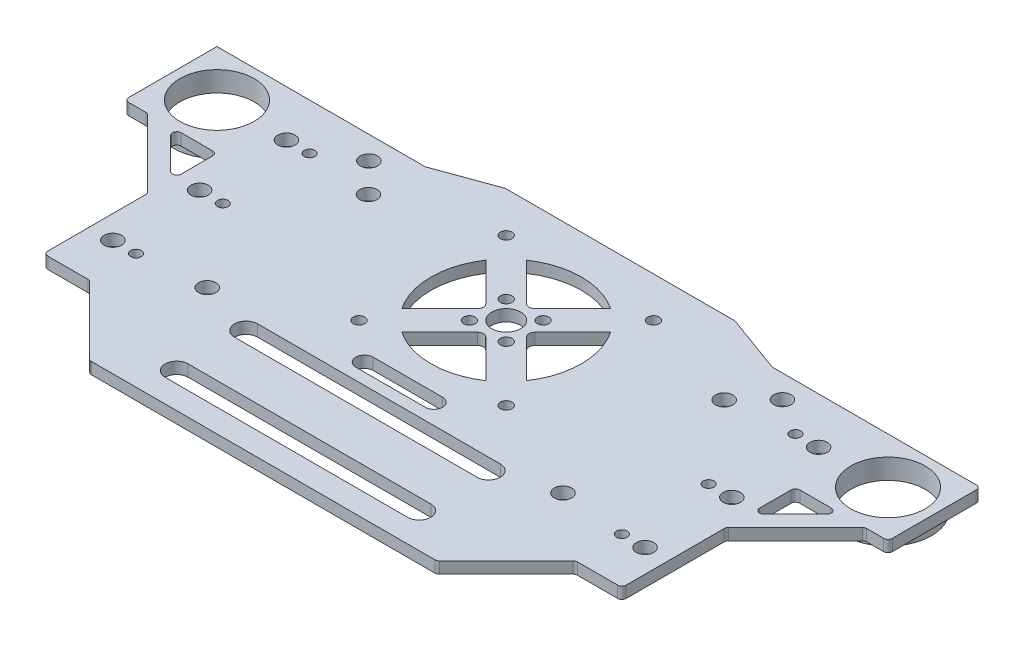
from build123d import *
from build123d.topology import SkipClean

# Parameters (mm, degrees)
SKETCH_1_R      = 1.5
SKETCH_1_R_2    = 0.925
SKETCH_1_R_3    = 1
SKETCH_1_R_4    = 15
SKETCH_1_R_5    = 2.5
SKETCH_1_R_6    = 6.425
EXTRUDE_1_DEPTH = 2
FILLET_1_R      = 0.75
EXTRUDE_START   = 1.5
SKETCH_3_R      = 7.5
SKETCH_3_R_2    = 6.425
EXTRUDE_2_DEPTH = 1.5


with BuildPart() as part:
    # 草图1 → 凸台-拉伸1 (new body)
    # profile 1 of 11: a face of its own
    with BuildSketch(Plane(origin=(0, 0, 0), x_dir=(1, 0, 0), z_dir=(0, 1, 0))):
        Polygon((-19.848034865, 26.695013128), (-30, 23), (30, 23), (19.848034865, 26.695013128), (0.026493373, 26.695013128), (-0.026493373, 26.695013128), align=None)
    # profile 2 of 11: a face of its own
    with BuildSketch(Plane(origin=(0, 0, 0), x_dir=(1, 0, 0), z_dir=(0, 1, 0))):
        Polygon((-19.848034865, 26.695013128), (-30, 23), (30, 23), (19.848034865, 26.695013128), (0.026493373, 26.695013128), (-0.026493373, 26.695013128), align=None)
    # profile 3 of 11: a face of its own
    with BuildSketch(Plane(origin=(0, 0, 0), x_dir=(1, 0, 0), z_dir=(0, 1, 0))):
        Polygon((-30, 23), (-50, 23), (-50, 7), (-50, -1), (-50, -5), (-50, -23), (-42, -23), (42, -23), (50, -23), (50, -5), (50, -1), (50, 7), (50, 23), (30, 23), align=None)
        with Locations(Location((-46, -15, 0), (0, 0, 270))):
            Circle(SKETCH_1_R, mode=Mode.SUBTRACT)
        with Locations(Location((-42, -15, 0), (0, 0, 270))):
            Circle(SKETCH_1_R_2, mode=Mode.SUBTRACT)
        with Locations(Location((-30.7465, -13.935, 0), (0, 0, 270))):
            Circle(SKETCH_1_R, mode=Mode.SUBTRACT)
        with Locations(Location((-12.727922061, -5.727922061, 0), (0, 0, 270))):
            Circle(SKETCH_1_R_3, mode=Mode.SUBTRACT)
        with BuildLine():
            ThreePointArc((-20.969611628, -19), (-22.969611628, -17), (-20.969611628, -15))
            Line((-20.969611628, -15), (20.969611628, -15))
            ThreePointArc((20.969611628, -15), (22.969611628, -17), (20.969611628, -19))
            Line((20.969611628, -19), (-20.969611628, -19))
        make_face(mode=Mode.SUBTRACT)
        with Locations(Location((30.7465, -13.935, 0), (0, 0, 270))):
            Circle(SKETCH_1_R, mode=Mode.SUBTRACT)
        with BuildLine():
            ThreePointArc((-6, -13), (-7.5, -11.5), (-6, -10))
            Line((-6, -10), (6, -10))
            ThreePointArc((6, -10), (7.5, -11.5), (6, -13))
            Line((6, -13), (-6, -13))
        make_face(mode=Mode.SUBTRACT)
        with Locations(Location((12.727922061, -5.727922061, 0), (0, 0, 270))):
            Circle(SKETCH_1_R_3, mode=Mode.SUBTRACT)
        with Locations(Location((42, -15, 0), (0, 0, 270))):
            Circle(SKETCH_1_R_2, mode=Mode.SUBTRACT)
        with Locations(Location((46, -15, 0), (0, 0, 270))):
            Circle(SKETCH_1_R, mode=Mode.SUBTRACT)
        with Locations(Location((-46, 0, 0), (0, 0, 270))):
            Circle(SKETCH_1_R, mode=Mode.SUBTRACT)
        with Locations(Location((-42, 0, 0), (0, 0, 270))):
            Circle(SKETCH_1_R_2, mode=Mode.SUBTRACT)
        with Locations(Location((-46, 15, 0), (0, 0, 270))):
            Circle(SKETCH_1_R, mode=Mode.SUBTRACT)
        with Locations(Location((-42, 15, 0), (0, 0, 270))):
            Circle(SKETCH_1_R_2, mode=Mode.SUBTRACT)
        with Locations(Location((-35.7465, 19, 0), (0, 0, 270))):
            Circle(SKETCH_1_R, mode=Mode.SUBTRACT)
        with Locations(Location((-30.7465, 13.935, 0), (0, 0, 270))):
            Circle(SKETCH_1_R, mode=Mode.SUBTRACT)
        with Locations(Location((-12.727922061, 19.727922061, 0), (0, 0, 270))):
            Circle(SKETCH_1_R_3, mode=Mode.SUBTRACT)
        with Locations((0, 7)):
            Circle(SKETCH_1_R_4, mode=Mode.SUBTRACT)
        with Locations(Location((42, 0, 0), (0, 0, 270))):
            Circle(SKETCH_1_R_2, mode=Mode.SUBTRACT)
        with Locations(Location((46, 0, 0), (0, 0, 270))):
            Circle(SKETCH_1_R, mode=Mode.SUBTRACT)
        with Locations(Location((30.7465, 13.935, 0), (0, 0, 270))):
            Circle(SKETCH_1_R, mode=Mode.SUBTRACT)
        with Locations(Location((12.727922061, 19.727922061, 0), (0, 0, 270))):
            Circle(SKETCH_1_R_3, mode=Mode.SUBTRACT)
        with Locations(Location((42, 15, 0), (0, 0, 270))):
            Circle(SKETCH_1_R_2, mode=Mode.SUBTRACT)
        with Locations(Location((46, 15, 0), (0, 0, 270))):
            Circle(SKETCH_1_R, mode=Mode.SUBTRACT)
        with Locations(Location((35.7465, 19, 0), (0, 0, 270))):
            Circle(SKETCH_1_R, mode=Mode.SUBTRACT)
    # profile 4 of 11: a face of its own
    with BuildSketch(Plane(origin=(0, 0, 0), x_dir=(1, 0, 0), z_dir=(0, 1, 0))):
        Polygon((-30, 23), (-50, 23), (-50, 7), (-50, -1), (-50, -5), (-50, -23), (-42, -23), (42, -23), (50, -23), (50, -5), (50, -1), (50, 7), (50, 23), (30, 23), align=None)
        with Locations(Location((-46, -15, 0), (0, 0, 270))):
            Circle(SKETCH_1_R, mode=Mode.SUBTRACT)
        with Locations(Location((-42, -15, 0), (0, 0, 270))):
            Circle(SKETCH_1_R_2, mode=Mode.SUBTRACT)
        with Locations(Location((-30.7465, -13.935, 0), (0, 0, 270))):
            Circle(SKETCH_1_R, mode=Mode.SUBTRACT)
        with Locations(Location((-12.727922061, -5.727922061, 0), (0, 0, 270))):
            Circle(SKETCH_1_R_3, mode=Mode.SUBTRACT)
        with BuildLine():
            ThreePointArc((-20.969611628, -19), (-22.969611628, -17), (-20.969611628, -15))
            Line((-20.969611628, -15), (20.969611628, -15))
            ThreePointArc((20.969611628, -15), (22.969611628, -17), (20.969611628, -19))
            Line((20.969611628, -19), (-20.969611628, -19))
        make_face(mode=Mode.SUBTRACT)
        with Locations(Location((30.7465, -13.935, 0), (0, 0, 270))):
            Circle(SKETCH_1_R, mode=Mode.SUBTRACT)
        with BuildLine():
            ThreePointArc((-6, -13), (-7.5, -11.5), (-6, -10))
            Line((-6, -10), (6, -10))
            ThreePointArc((6, -10), (7.5, -11.5), (6, -13))
            Line((6, -13), (-6, -13))
        make_face(mode=Mode.SUBTRACT)
        with Locations(Location((12.727922061, -5.727922061, 0), (0, 0, 270))):
            Circle(SKETCH_1_R_3, mode=Mode.SUBTRACT)
        with Locations(Location((42, -15, 0), (0, 0, 270))):
            Circle(SKETCH_1_R_2, mode=Mode.SUBTRACT)
        with Locations(Location((46, -15, 0), (0, 0, 270))):
            Circle(SKETCH_1_R, mode=Mode.SUBTRACT)
        with Locations(Location((-46, 0, 0), (0, 0, 270))):
            Circle(SKETCH_1_R, mode=Mode.SUBTRACT)
        with Locations(Location((-42, 0, 0), (0, 0, 270))):
            Circle(SKETCH_1_R_2, mode=Mode.SUBTRACT)
        with Locations(Location((-46, 15, 0), (0, 0, 270))):
            Circle(SKETCH_1_R, mode=Mode.SUBTRACT)
        with Locations(Location((-42, 15, 0), (0, 0, 270))):
            Circle(SKETCH_1_R_2, mode=Mode.SUBTRACT)
        with Locations(Location((-35.7465, 19, 0), (0, 0, 270))):
            Circle(SKETCH_1_R, mode=Mode.SUBTRACT)
        with Locations(Location((-30.7465, 13.935, 0), (0, 0, 270))):
            Circle(SKETCH_1_R, mode=Mode.SUBTRACT)
        with Locations(Location((-12.727922061, 19.727922061, 0), (0, 0, 270))):
            Circle(SKETCH_1_R_3, mode=Mode.SUBTRACT)
        with Locations((0, 7)):
            Circle(SKETCH_1_R_4, mode=Mode.SUBTRACT)
        with Locations(Location((42, 0, 0), (0, 0, 270))):
            Circle(SKETCH_1_R_2, mode=Mode.SUBTRACT)
        with Locations(Location((46, 0, 0), (0, 0, 270))):
            Circle(SKETCH_1_R, mode=Mode.SUBTRACT)
        with Locations(Location((30.7465, 13.935, 0), (0, 0, 270))):
            Circle(SKETCH_1_R, mode=Mode.SUBTRACT)
        with Locations(Location((12.727922061, 19.727922061, 0), (0, 0, 270))):
            Circle(SKETCH_1_R_3, mode=Mode.SUBTRACT)
        with Locations(Location((42, 15, 0), (0, 0, 270))):
            Circle(SKETCH_1_R_2, mode=Mode.SUBTRACT)
        with Locations(Location((46, 15, 0), (0, 0, 270))):
            Circle(SKETCH_1_R, mode=Mode.SUBTRACT)
        with Locations(Location((35.7465, 19, 0), (0, 0, 270))):
            Circle(SKETCH_1_R, mode=Mode.SUBTRACT)
    # profile 5 of 11: a face of its own
    with BuildSketch(Plane(origin=(0, 0, 0), x_dir=(1, 0, 0), z_dir=(0, 1, 0))):
        with Locations((0, 7)):
            Circle(SKETCH_1_R_4)
        with BuildLine():
            ThreePointArc((13, 7), (12.434860091, 3.208660592), (10.788576229, -0.253042323))
            ThreePointArc((10.788576229, -0.253042323), (9.192388155, -2.192388155), (7.253042323, -3.788576229))
            ThreePointArc((7.253042323, -3.788576229), (0, -6), (-7.253042323, -3.788576229))
            ThreePointArc((-7.253042323, -3.788576229), (-9.192388155, -2.192388155), (-10.788576229, -0.253042323))
            ThreePointArc((-10.788576229, -0.253042323), (-13, 7), (-10.788576229, 14.253042323))
            ThreePointArc((-10.788576229, 14.253042323), (-9.192388155, 16.192388155), (-7.253042323, 17.788576229))
            ThreePointArc((-7.253042323, 17.788576229), (0, 20), (7.253042323, 17.788576229))
            ThreePointArc((7.253042323, 17.788576229), (9.192388155, 16.192388155), (10.788576229, 14.253042323))
            ThreePointArc((10.788576229, 14.253042323), (12.434860091, 10.791339408), (13, 7))
        make_face(mode=Mode.SUBTRACT)
    # profile 6 of 11: a face of its own
    with BuildSketch(Plane(origin=(0, 0, 0), x_dir=(1, 0, 0), z_dir=(0, 1, 0))):
        with BuildLine():
            ThreePointArc((7.253042323, -3.788576229), (9.192388155, -2.192388155), (10.788576229, -0.253042323))
            Line((10.788576229, -0.253042323), (4.242640687, 6.292893219))
            ThreePointArc((4.242640687, 6.292893219), (3.949747468, 7), (4.242640687, 7.707106781))
            Line((4.242640687, 7.707106781), (10.788576229, 14.253042323))
            ThreePointArc((10.788576229, 14.253042323), (9.192388155, 16.192388155), (7.253042323, 17.788576229))
            Line((7.253042323, 17.788576229), (0.707106781, 11.242640687))
            ThreePointArc((0.707106781, 11.242640687), (0, 10.949747468), (-0.707106781, 11.242640687))
            Line((-0.707106781, 11.242640687), (-7.253042323, 17.788576229))
            ThreePointArc((-7.253042323, 17.788576229), (-9.192388155, 16.192388155), (-10.788576229, 14.253042323))
            Line((-10.788576229, 14.253042323), (-4.242640687, 7.707106781))
            ThreePointArc((-4.242640687, 7.707106781), (-3.949747468, 7), (-4.242640687, 6.292893219))
            Line((-4.242640687, 6.292893219), (-10.788576229, -0.253042323))
            ThreePointArc((-10.788576229, -0.253042323), (-9.192388155, -2.192388155), (-7.253042323, -3.788576229))
            Line((-7.253042323, -3.788576229), (-0.707106781, 2.757359313))
            ThreePointArc((-0.707106781, 2.757359313), (0, 3.050252532), (0.707106781, 2.757359313))
            Line((0.707106781, 2.757359313), (7.253042323, -3.788576229))
        make_face()
        with Locations(Location((-3.181980515, 3.818019485, 0), (0, 0, 270))):
            Circle(SKETCH_1_R_3, mode=Mode.SUBTRACT)
        with Locations(Location((-3.181980515, 10.181980515, 0), (0, 0, 270))):
            Circle(SKETCH_1_R_3, mode=Mode.SUBTRACT)
        with Locations(Location((3.181980515, 3.818019485, 0), (0, 0, 270))):
            Circle(SKETCH_1_R_3, mode=Mode.SUBTRACT)
        with Locations(Location((0, 7, 0), (0, 0, 270))):
            Circle(SKETCH_1_R_5, mode=Mode.SUBTRACT)
        with Locations(Location((3.181980515, 10.181980515, 0), (0, 0, 270))):
            Circle(SKETCH_1_R_3, mode=Mode.SUBTRACT)
    # profile 7 of 11: a face of its own
    with BuildSketch(Plane(origin=(0, 0, 0), x_dir=(1, 0, 0), z_dir=(0, 1, 0))):
        Polygon((42, -23), (-42, -23), (-30, -35), (30, -35), align=None)
        with BuildLine():
            ThreePointArc((-20.969611628, -31), (-22.969611628, -29), (-20.969611628, -27))
            Line((-20.969611628, -27), (20.969611628, -27))
            ThreePointArc((20.969611628, -27), (22.969611628, -29), (20.969611628, -31))
            Line((20.969611628, -31), (-20.969611628, -31))
        make_face(mode=Mode.SUBTRACT)
    # profile 8 of 11: a face of its own
    with BuildSketch(Plane(origin=(0, 0, 0), x_dir=(1, 0, 0), z_dir=(0, 1, 0))):
        Polygon((-50, -5), (-50, -1), (-58, 7), (-62, 7), align=None)
    # profile 9 of 11: a face of its own
    with BuildSketch(Plane(origin=(0, 0, 0), x_dir=(1, 0, 0), z_dir=(0, 1, 0))):
        Polygon((-50, 7), (-50, 23), (-66, 23), (-66, 7), (-62, 7), (-58, 7), align=None)
        with Locations(Location((-58, 15, 0), (0, 0, 270))):
            Circle(SKETCH_1_R_6, mode=Mode.SUBTRACT)
    # profile 10 of 11: a face of its own
    with BuildSketch(Plane(origin=(0, 0, 0), x_dir=(1, 0, 0), z_dir=(0, 1, 0))):
        Polygon((66, 23), (50, 23), (50, 7), (58, 7), (62, 7), (66, 7), align=None)
        with Locations(Location((58, 15, 0), (0, 0, 270))):
            Circle(SKETCH_1_R_6, mode=Mode.SUBTRACT)
    # profile 11 of 11: a face of its own
    with BuildSketch(Plane(origin=(0, 0, 0), x_dir=(1, 0, 0), z_dir=(0, 1, 0))):
        Polygon((58, 7), (50, -1), (50, -5), (62, 7), align=None)
    extrude(amount=EXTRUDE_1_DEPTH)

    # 圆角1
    fillet_1_edges = [part.edges().sort_by_distance(p)[0] for p in [
        (66, 1, -23),
        (66, 1, -7),
        (62, 1, -7),
        (50, 1, 5),
        (50, 1, 23),
        (42, 1, 23),
        (30, 1, 35),
        (-30, 1, 35),
        (-42, 1, 23),
        (-50, 1, 23),
        (-50, 1, 5),
        (-62, 1, -7),
        (-66, 1, -7),
        (50, 1, -7),
        (50, 1, 1),
        (58, 1, -7),
        (-50, 1, 1),
        (-50, 1, -7),
        (-58, 1, -7),
    ]]
    fillet(fillet_1_edges, radius=FILLET_1_R)

    # 草图3 → 凸台-拉伸2 (add)
    # profile 1 of 2: a face of its own
    with SkipClean():  # the faces are left unmerged after this step: merging them gives an invalid solid
        with BuildSketch(Plane.XZ.offset(EXTRUDE_START)):
            with Locations(Location((-58, -15, 0), (0, 0, 90))):
                Circle(SKETCH_3_R)
            with Locations(Location((-58, -15, 0), (0, 0, 270))):
                Circle(SKETCH_3_R_2, mode=Mode.SUBTRACT)
        # profile 2 of 2: a face of its own
        with BuildSketch(Plane.XZ.offset(EXTRUDE_START)):
            with Locations(Location((58, -15, 0), (0, 0, 90))):
                Circle(SKETCH_3_R)
            with Locations(Location((58, -15, 0), (0, 0, 90))):
                Circle(SKETCH_3_R_2, mode=Mode.SUBTRACT)
        extrude(amount=-EXTRUDE_2_DEPTH)


solid = part.part
